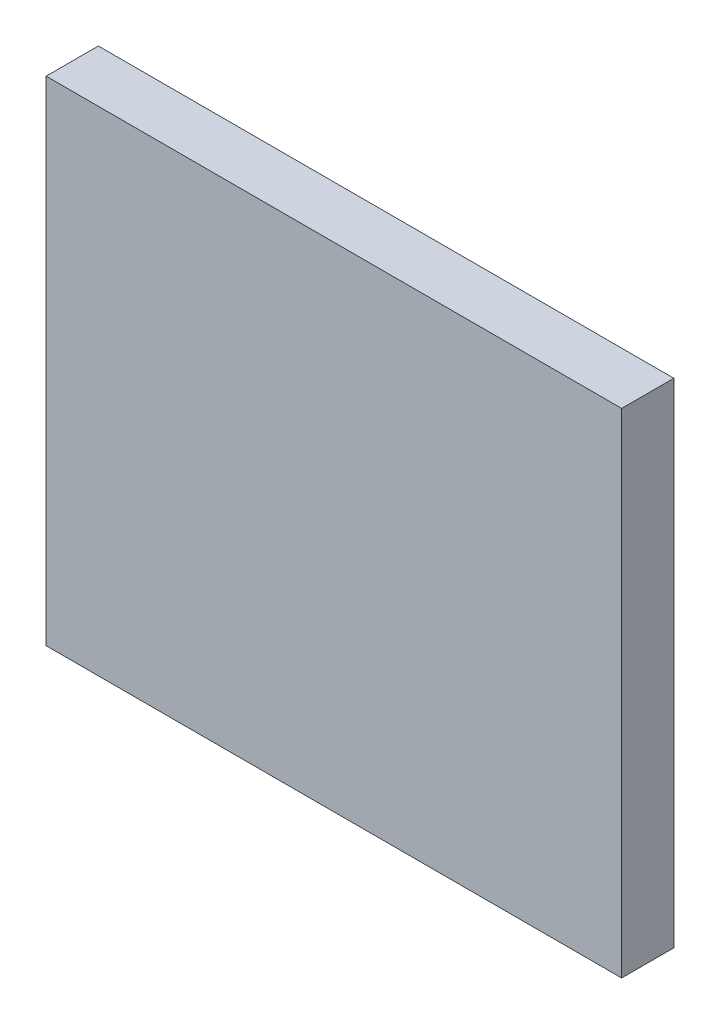
from build123d import *

# Parameters (mm, degrees)
SKETCH1_W           = 280
SKETCH1_H           = 240
BOSS_EXTRUDE1_DEPTH = 25.4


with BuildPart() as part:
    # Sketch1 → Boss-Extrude1 (new body)
    with BuildSketch(Plane.XY):
        Rectangle(SKETCH1_W, SKETCH1_H)
    extrude(amount=BOSS_EXTRUDE1_DEPTH)


solid = part.part
